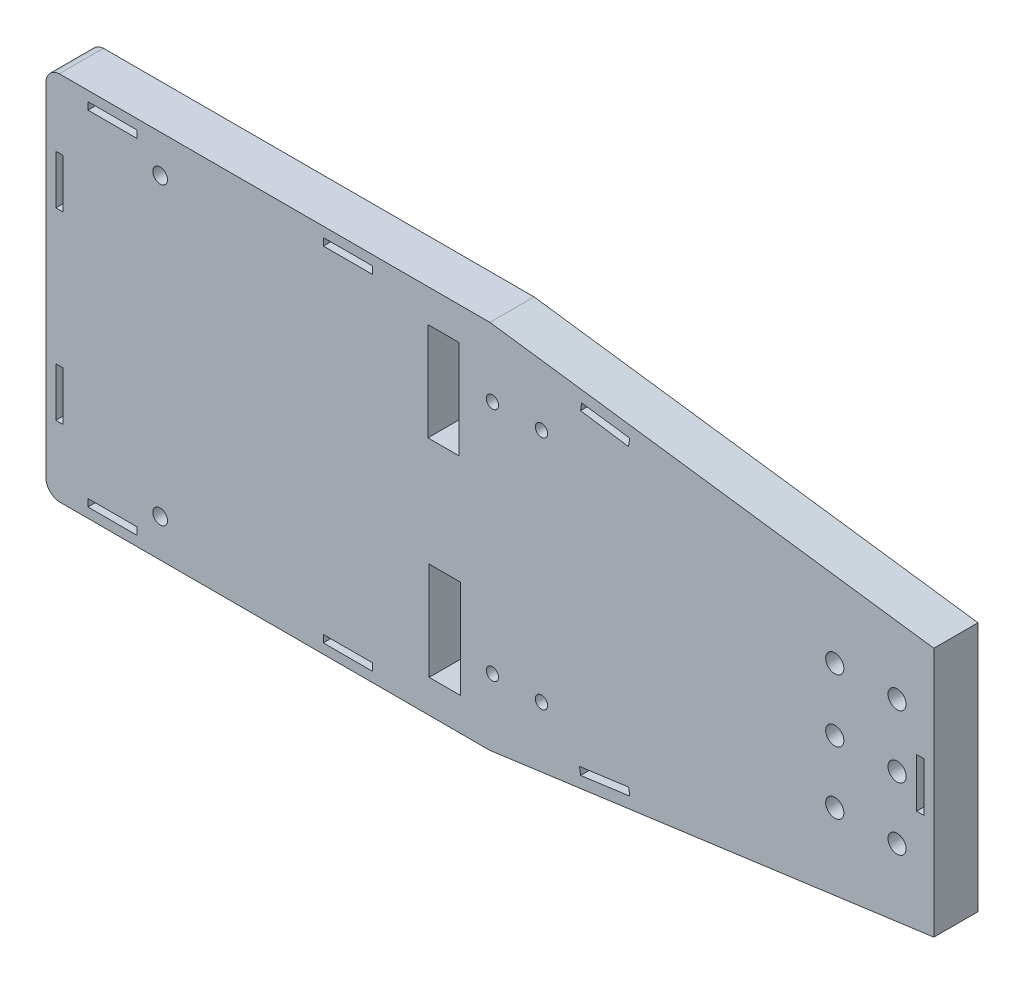
from build123d import *

# Parameters (mm, degrees)
SKETCH1_W           = 181
SKETCH1_H           = 75.57
BOSS_EXTRUDE2_DEPTH = 9
SKETCH6_W           = 1.5
SKETCH6_H           = 10
SKETCH6_R           = 1.85
SKETCH6_R_2         = 1.25
SKETCH6_W_2         = 6.368125956
SKETCH6_H_2         = 20
SKETCH6_W_3         = 6.368125955
SKETCH6_W_4         = 10
SKETCH6_H_3         = 1.5
SKETCH6_R_3         = 1.5
CUT_EXTRUDE7_DEPTH  = 9


with BuildPart() as part:
    # Sketch1 → Boss-Extrude2 (new body)
    with BuildSketch(Plane.XY):
        Rectangle(SKETCH1_W, SKETCH1_H)
    extrude(amount=BOSS_EXTRUDE2_DEPTH)

    # Sketch6 → Cut-Extrude7 (cut)
    with BuildSketch(Plane.XY.offset(9)):
        Polygon((90.5, -25.503407437), (0, -37.785), (90.5, -37.785), align=None)
        Polygon((90.5, 37.785), (0, 37.785), (90.5, 25.503407437), align=None)
        with Locations((87.75, -0.017122468)):
            Rectangle(SKETCH6_W, SKETCH6_H)
        with Locations((83, 0)):
            Circle(SKETCH6_R)
        with Locations((83, -12.753407437)):
            Circle(SKETCH6_R)
        with Locations((70.3, -12.753407437)):
            Circle(SKETCH6_R)
        with Locations((70.3, 0)):
            Circle(SKETCH6_R)
        with Locations((70.3, 12.753407437)):
            Circle(SKETCH6_R)
        with Locations((83, 12.753407437)):
            Circle(SKETCH6_R)
        Polygon((18.699571513, 32.929403247), (28.501771515, 31.599164279), (28.260126082, 29.976752052), (18.476794857, 31.446038639), align=None)
        with Locations((10.504840582, 24)):
            Circle(SKETCH6_R_2)
        with Locations((0.504840582, 24)):
            Circle(SKETCH6_R_2)
        with Locations((-9.454971277, 21.080969171)):
            Rectangle(SKETCH6_W_2, SKETCH6_H_2)
        with Locations((-9.205288194, -21.08)):
            Rectangle(SKETCH6_W_3, SKETCH6_H_2)
        with Locations((0.504840582, -24)):
            Circle(SKETCH6_R_2)
        with Locations((10.504840582, -24)):
            Circle(SKETCH6_R_2)
        Polygon((18.472571869, -32.963494813), (28.501771515, -31.60245013), (28.279412419, -30.118876563), (18.270858535, -31.477119446), align=None)
        with Locations((-28.962631903, 35.035)):
            Rectangle(SKETCH6_W_4, SKETCH6_H_3)
        with Locations((-76.947155779, 35.035)):
            Rectangle(SKETCH6_W_4, SKETCH6_H_3)
        with Locations((-67.23, 30.095)):
            Circle(SKETCH6_R_3)
        with BuildLine():
            Line((-90.5, 37.785), (-90.5, 35.274795088))
            ThreePointArc((-90.5, 35.274795088), (-89.587457665, 37.010103297), (-87.786468161, 37.785))
            Line((-87.786468161, 37.785), (-90.5, 37.785))
        make_face()
        with Locations((-87.75, 18.75)):
            Rectangle(SKETCH6_W, SKETCH6_H)
        with Locations((-87.75, -18.75)):
            Rectangle(SKETCH6_W, SKETCH6_H)
        with BuildLine():
            ThreePointArc((-87.786468161, -37.785), (-89.587457665, -37.010103297), (-90.5, -35.274795088))
            Line((-90.5, -35.274795088), (-90.5, -37.785))
            Line((-90.5, -37.785), (-87.786468161, -37.785))
        make_face()
        with Locations((-76.947155779, -35.035)):
            Rectangle(SKETCH6_W_4, SKETCH6_H_3)
        with Locations((-67.23, -30.095)):
            Circle(SKETCH6_R_3)
        with Locations((-28.962631903, -35.035)):
            Rectangle(SKETCH6_W_4, SKETCH6_H_3)
    extrude(amount=-CUT_EXTRUDE7_DEPTH, mode=Mode.SUBTRACT)


solid = part.part
